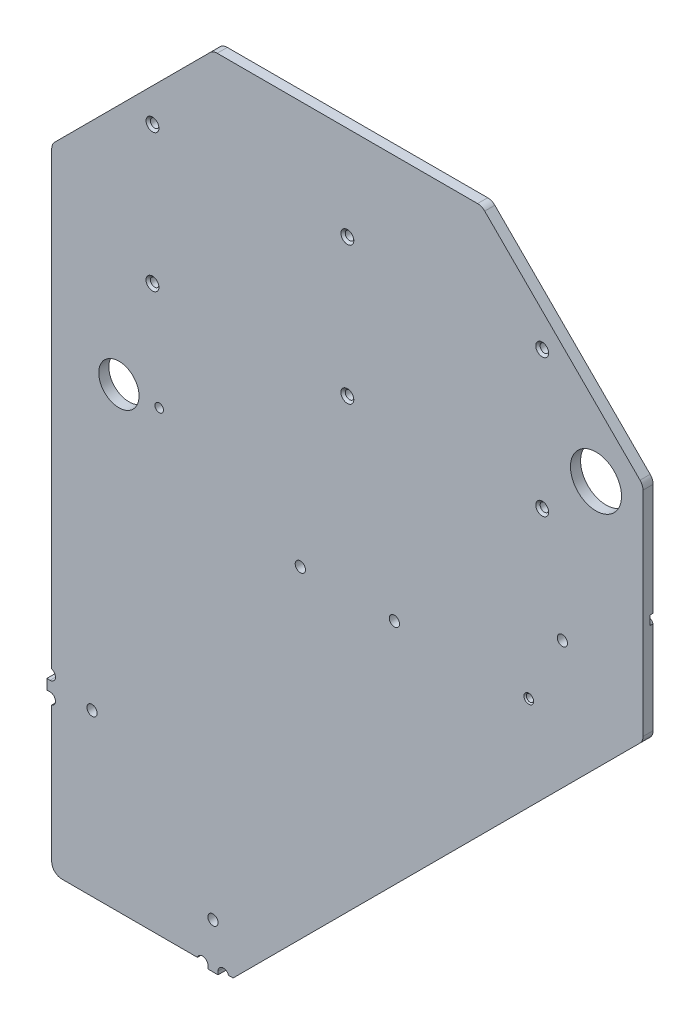
from build123d import *

# Parameters (mm, degrees)
BOSS_EXTRUDE1_DEPTH             = 4.7752
SKETCH5_R                       = 12.065
CE_00_TUBE_HOLE_DEPTH           = 277.520788418
F_10_32_TAPPED_HOLE1_AT_2_COUNT = 2
F_10_32_TAPPED_HOLE1_AT_2_PITCH = 65.1002
F_10_32_TAPPED_HOLE1_AT_3_COUNT = 2
F_10_32_TAPPED_HOLE1_AT_3_PITCH = 92.075
F_10_32_TAPPED_HOLE1_AT_4_COUNT = 2
F_10_32_TAPPED_HOLE1_AT_4_PITCH = 112.764540814
F_10_32_TAPPED_HOLE1_AT_5_COUNT = 2
F_10_32_TAPPED_HOLE1_AT_5_PITCH = 184.15
F_10_32_TAPPED_HOLE1_AT_6_COUNT = 2
F_10_32_TAPPED_HOLE1_AT_6_PITCH = 195.318351775
F_11_0_191_DIAMETER_HOLE1_D     = 4.8514
F_11_0_191_DIAMETER_HOLE2_D     = 4.8514
CE_00_SHELF_GROOVE_DEPTH        = 1.5748
CE_00_RELIEF_GROOVE_DEPTH       = 2.286
SKETCH18_R                      = 18.2499
SKETCH18_R_2                    = 14.2875
CE_00_TUBE_GASKET_GROOVE_DEPTH  = 3.175
CE_00_TABE_FEATURES_DEPTH       = 277.520788418
FILLET1_R                       = 4.7752
SKETCH22_R                      = 9.525
SKETCH22_R_2                    = 2.0193
CUT_EXTRUDE1_DEPTH              = 277.520788418


with BuildPart() as part:
    # Sketch1 → Boss-Extrude1 (new body)
    with BuildSketch(Plane.XY):
        with BuildLine():
            Line((63.5, 139.7), (139.7, 63.5))
            Line((139.7, 63.5), (139.7, -41.275))
            Line((139.7, -41.275), (-53.975, -234.95))
            Line((-53.975, -234.95), (-56.869763556, -234.95))
            ThreePointArc((-56.869763556, -234.95), (-59.279419133, -235.557868517), (-61.1124, -237.236))
            Line((-61.1124, -237.236), (-65.8876, -237.236))
            ThreePointArc((-65.8876, -237.236), (-67.720580867, -235.557868517), (-70.130236444, -234.95))
            Line((-70.130236444, -234.95), (-139.7, -234.95))
            Line((-139.7, -234.95), (-139.7, -165.380236444))
            ThreePointArc((-139.7, -165.380236444), (-140.307868517, -162.970580867), (-141.986, -161.1376))
            Line((-141.986, -161.1376), (-141.986, -156.3624))
            ThreePointArc((-141.986, -156.3624), (-140.307868517, -154.529419133), (-139.7, -152.119763556))
            Line((-139.7, -152.119763556), (-139.7, 63.5))
            Line((-139.7, 63.5), (-63.5, 139.7))
            Line((-63.5, 139.7), (63.5, 139.7))
        make_face()
    extrude(amount=BOSS_EXTRUDE1_DEPTH)

    # Sketch5 → CE-00 TUbe Hole (cut, through all)
    with BuildSketch(Plane.XY):
        with Locations((117.475, 53.975)):
            Circle(SKETCH5_R)
    extrude(amount=CE_00_TUBE_HOLE_DEPTH, mode=Mode.SUBTRACT)

    # Sketch6 → #10-32 Tapped Hole1 (revolve, cut)
    with BuildSketch(Plane(origin=(-92.075, 95.2754, 0), x_dir=(0, 1, 0), z_dir=(1, 0, 0))):
        Polygon((0, 0), (0, 4.7752), (3.048, 4.7752), (2.0193, 3.7465), (2.0193, 1.0287), (3.048, 0), align=None)
    f_10_32_tapped_hole1 = revolve(axis=Axis((-92.075, 95.2754, -6.35), (0, 0, 1)), mode=Mode.SUBTRACT)

    # #10-32 Tapped Hole1 at 2: #10-32 Tapped Hole1 ×2
    with Locations(*[(0, -i * F_10_32_TAPPED_HOLE1_AT_2_PITCH, 0) for i in range(1, F_10_32_TAPPED_HOLE1_AT_2_COUNT)]):
        add(f_10_32_tapped_hole1, mode=Mode.SUBTRACT)

    # #10-32 Tapped Hole1 at 3: #10-32 Tapped Hole1 ×2
    with Locations(*[(i * F_10_32_TAPPED_HOLE1_AT_3_PITCH, 0, 0) for i in range(1, F_10_32_TAPPED_HOLE1_AT_3_COUNT)]):
        add(f_10_32_tapped_hole1, mode=Mode.SUBTRACT)

    # #10-32 Tapped Hole1 at 4: #10-32 Tapped Hole1 ×2
    with Locations(*[Vector(0.8165244086055451, -0.5773109128982101, 0) * (i * F_10_32_TAPPED_HOLE1_AT_4_PITCH) for i in range(1, F_10_32_TAPPED_HOLE1_AT_4_COUNT)]):
        add(f_10_32_tapped_hole1, mode=Mode.SUBTRACT)

    # #10-32 Tapped Hole1 at 5: #10-32 Tapped Hole1 ×2
    with Locations(*[(i * F_10_32_TAPPED_HOLE1_AT_5_PITCH, 0, 0) for i in range(1, F_10_32_TAPPED_HOLE1_AT_5_COUNT)]):
        add(f_10_32_tapped_hole1, mode=Mode.SUBTRACT)

    # #10-32 Tapped Hole1 at 6: #10-32 Tapped Hole1 ×2
    with Locations(*[Vector(0.9428197520952135, -0.3333030378786251, 0) * (i * F_10_32_TAPPED_HOLE1_AT_6_PITCH) for i in range(1, F_10_32_TAPPED_HOLE1_AT_6_COUNT)]):
        add(f_10_32_tapped_hole1, mode=Mode.SUBTRACT)

    # #11 (0.191) Diameter Hole1 (through all)
    with Locations(Plane(origin=(0, 0, 0), x_dir=(-1, 0, 0), z_dir=(0, 0, -1))):
        with Locations((-22.225, -50.8), (22.225, -50.8)):
            Hole(F_11_0_191_DIAMETER_HOLE1_D / 2)

    # #11 (0.191) Diameter Hole2 (through all)
    with Locations(Plane(origin=(0, 0, 0), x_dir=(-1, 0, 0), z_dir=(0, 0, -1))):
        with Locations((101.6, -19.05), (120.65, -158.75), (63.5, -215.9), (-101.6, -19.05)):
            Hole(F_11_0_191_DIAMETER_HOLE2_D / 2)

    # Sketch20 → #8-32 Tapped Hole1 (revolve, cut)
    with BuildSketch(Plane(origin=(85.725, -50.8, 0), x_dir=(0, 1, 0), z_dir=(1, 0, 0))):
        Polygon((0, 0), (0, 4.7752), (2.286, 4.7752), (1.7272, 4.2164), (1.7272, 0.5588), (2.286, 0), align=None)
    revolve(axis=Axis((85.725, -50.8, -6.35), (0, 0, 1)), mode=Mode.SUBTRACT)

    # Sketch10 → CE-00 Shelf Groove (cut)
    with BuildSketch(Plane.XY):
        with BuildLine():
            Line((-162.687, 8.763), (158.242, 8.763))
            Line((158.242, 8.763), (158.242, -51.188217219))
            Line((158.242, -51.188217219), (139.954, -51.188217219))
            Line((139.954, -51.188217219), (139.954, 3.175))
            ThreePointArc((139.954, 3.175), (139.02406403, 5.42006403), (136.779, 6.35))
            Line((136.779, 6.35), (-134.112, 6.35))
            ThreePointArc((-134.112, 6.35), (-136.35706403, 5.42006403), (-137.287, 3.175))
            Line((-137.287, 3.175), (-137.287, -15.875))
            ThreePointArc((-137.287, -15.875), (-139.370056572, -20.903943428), (-144.399, -22.987))
            Line((-144.399, -22.987), (-162.687, -22.987))
            Line((-162.687, -22.987), (-162.687, 8.763))
        make_face()
    extrude(amount=CE_00_SHELF_GROOVE_DEPTH, mode=Mode.SUBTRACT)

    # Sketch17 → CE-00 Relief Groove (cut)
    with BuildSketch(Plane(origin=(0, 0, 0), x_dir=(-1, 0, 0), z_dir=(0, 0, -1))):
        with BuildLine():
            Line((130.9624, -2.667), (-133.604, -2.667))
            ThreePointArc((-133.604, -2.667), (-136.906, 0.635), (-133.604, 3.937))
            Line((-133.604, 3.937), (130.9624, 3.937))
            ThreePointArc((130.9624, 3.937), (134.2644, 0.635), (130.9624, -2.667))
        make_face()
    extrude(amount=-CE_00_RELIEF_GROOVE_DEPTH, mode=Mode.SUBTRACT)

    # Sketch18 → CE-00 Tube Gasket Groove (cut)
    with BuildSketch(Plane(origin=(0, 0, 0), x_dir=(-1, 0, 0), z_dir=(0, 0, -1))):
        with Locations((-117.475, 53.721)):
            Circle(SKETCH18_R)
        with Locations((-117.475, 53.721)):
            Circle(SKETCH18_R_2, mode=Mode.SUBTRACT)
    extrude(amount=-CE_00_TUBE_GASKET_GROOVE_DEPTH, mode=Mode.SUBTRACT)

    # Sketch19 → CE-00 Tabe Features (cut, through all)
    with BuildSketch(Plane.XY):
        with BuildLine():
            Line((-141.986, -156.3624), (-141.986, -161.1376))
            Line((-141.986, -161.1376), (-140.462, -161.1376))
            ThreePointArc((-140.462, -161.1376), (-137.922, -163.6776), (-140.462, -166.2176))
            Line((-140.462, -166.2176), (-144.526, -166.2176))
            Line((-144.526, -166.2176), (-144.526, -151.2824))
            Line((-144.526, -151.2824), (-140.462, -151.2824))
            ThreePointArc((-140.462, -151.2824), (-137.922, -153.8224), (-140.462, -156.3624))
            Line((-140.462, -156.3624), (-141.986, -156.3624))
        make_face()
        with BuildLine():
            Line((-61.1124, -237.236), (-65.8876, -237.236))
            Line((-65.8876, -237.236), (-65.8876, -235.712))
            ThreePointArc((-65.8876, -235.712), (-68.4276, -233.172), (-70.9676, -235.712))
            Line((-70.9676, -235.712), (-70.9676, -244.467339737))
            Line((-70.9676, -244.467339737), (-56.0324, -244.467339737))
            Line((-56.0324, -244.467339737), (-56.0324, -235.712))
            ThreePointArc((-56.0324, -235.712), (-58.5724, -233.172), (-61.1124, -235.712))
            Line((-61.1124, -235.712), (-61.1124, -237.236))
        make_face()
    extrude(amount=CE_00_TABE_FEATURES_DEPTH, mode=Mode.SUBTRACT)

    # Fillet1
    fillet1_edges = [part.edges().sort_by_distance(p)[0] for p in [
        (-139.7, -234.95, 2.3876),
        (-139.7, 63.5, 2.3876),
        (-63.5, 139.7, 2.3876),
        (63.5, 139.7, 2.3876),
        (139.7, 63.5, 2.3876),
        (139.7, -41.275, 2.3876),
    ]]
    fillet(fillet1_edges, radius=FILLET1_R)

    # Sketch22 → Cut-Extrude1 (cut, through all)
    with BuildSketch(Plane.XY):
        with Locations((-107.95, -19.05)):
            Circle(SKETCH22_R)
        with Locations((-88.900016933, -19.0754)):
            Circle(SKETCH22_R_2)
    extrude(amount=CUT_EXTRUDE1_DEPTH, mode=Mode.SUBTRACT)


solid = part.part
